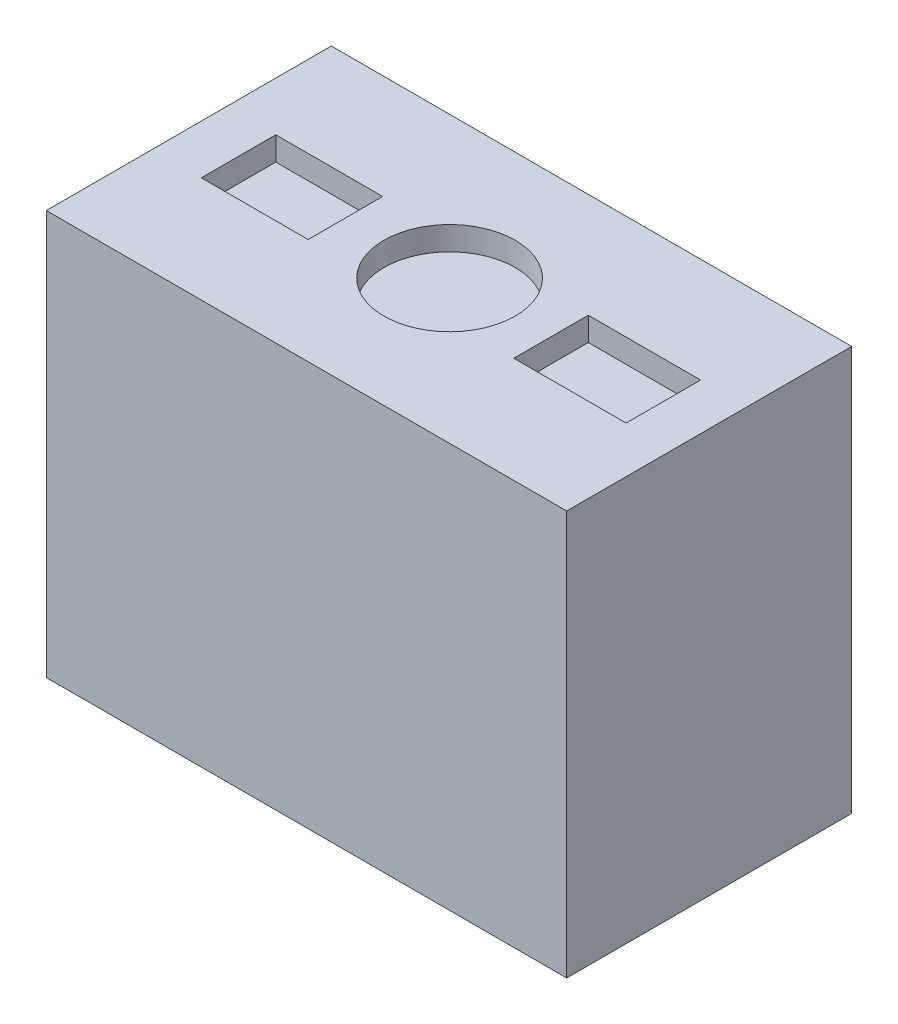
from build123d import *

# Parameters (mm, degrees)
SKETCH1_W           = 22
SKETCH1_H           = 17.1
BOSS_EXTRUDE1_DEPTH = 12.05
CUT_EXTRUDE1_START  = 8.55
SKETCH2_R           = 2.77735613
SKETCH2_W           = 4.746499011
SKETCH2_H           = 3.149119536
SKETCH2_W_2         = 4.518301943
CUT_EXTRUDE1_DEPTH  = 1


with BuildPart() as part:
    # Sketch1 → Boss-Extrude1 (new body)
    with BuildSketch(Plane.XY):
        Rectangle(SKETCH1_W, SKETCH1_H)
    extrude(amount=BOSS_EXTRUDE1_DEPTH)

    # Sketch2 → Cut-Extrude1 (cut)
    with BuildSketch(Plane(origin=(0, 0, 0), x_dir=(1, 0, 0), z_dir=(0, 1, 0)).offset(CUT_EXTRUDE1_START)):
        with Locations(Location((0, -6, 0), (0, 0, 90))):
            Circle(SKETCH2_R)
        with Locations((6.663354381, -6)):
            Rectangle(SKETCH2_W, SKETCH2_H)
        with Locations((-6.663354381, -6)):
            Rectangle(SKETCH2_W_2, SKETCH2_H)
    extrude(amount=-CUT_EXTRUDE1_DEPTH, mode=Mode.SUBTRACT)


solid = part.part
